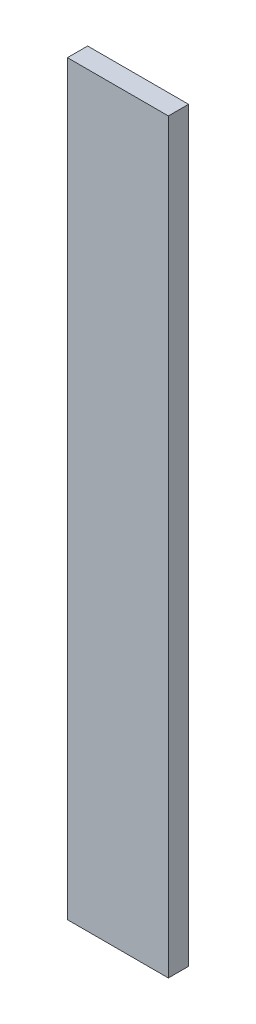
from build123d import *

# Parameters (mm, degrees)
SKETCH_1_W      = 10
SKETCH_1_H      = 73.974752349
EXTRUDE_1_DEPTH = 2


with BuildPart() as part:
    # 草图1 → 凸台-拉伸1 (new body)
    with BuildSketch(Plane(origin=(0, 0, 120.017510674), x_dir=(-1, 0, 0), z_dir=(0, 0, -1))):
        with Locations((-45.621681972, 2.047988451)):
            Rectangle(SKETCH_1_W, SKETCH_1_H)
    extrude(amount=EXTRUDE_1_DEPTH)


solid = part.part
